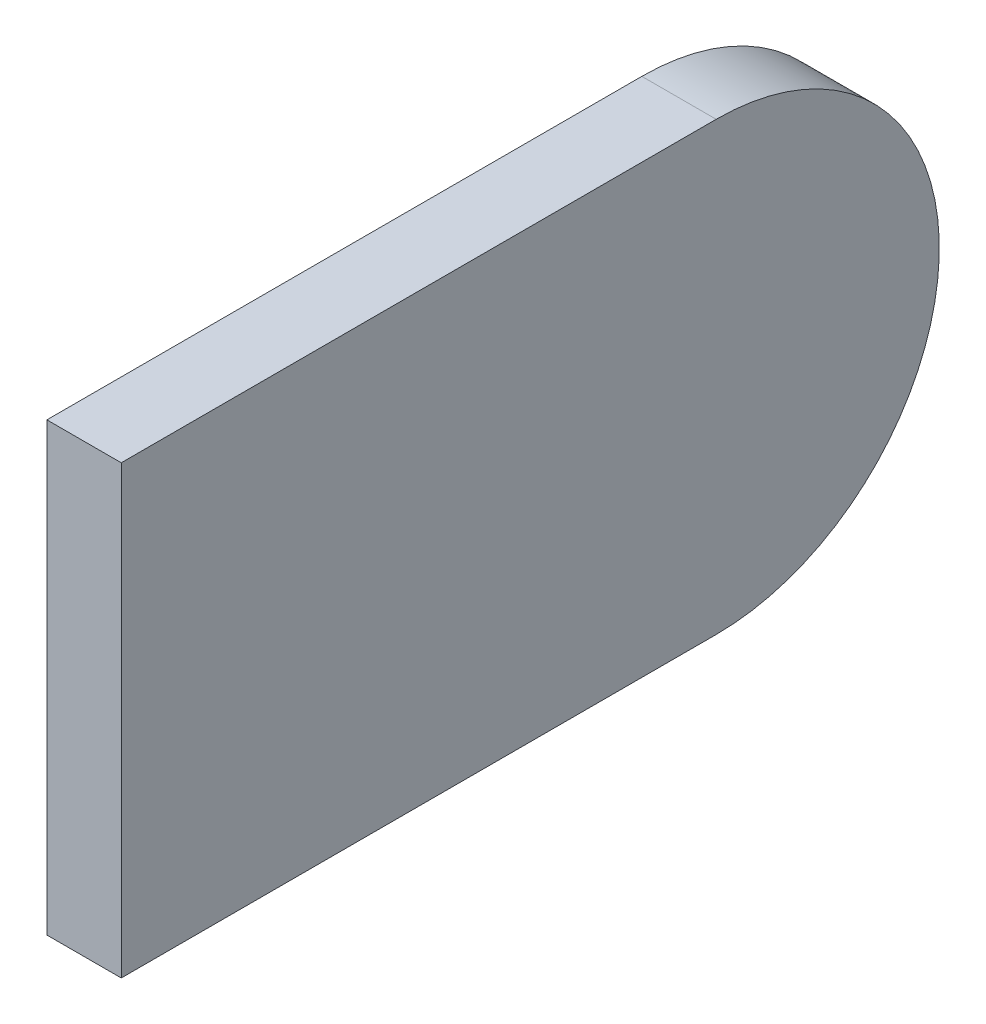
from build123d import *

# Parameters (mm, degrees)
BOSS_EXTRUDE1_DEPTH = 10


with BuildPart() as part:
    # Sketch1 → Boss-Extrude1 (new body)
    with BuildSketch(Plane(origin=(0, 0, 0), x_dir=(0, 0, -1), z_dir=(1, 0, 0))):
        with BuildLine():
            Line((0, 0), (0, 60))
            Line((0, 60), (80, 60))
            ThreePointArc((80, 60), (110, 30), (80, 0))
            Line((80, 0), (0, 0))
        make_face()
    extrude(amount=BOSS_EXTRUDE1_DEPTH)


solid = part.part
